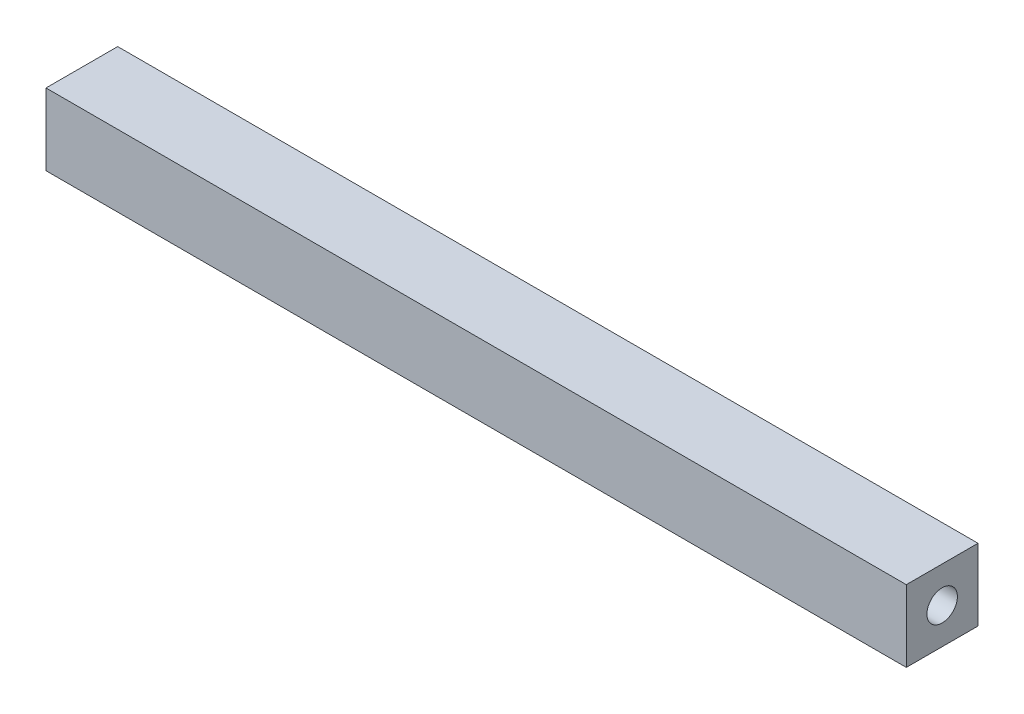
from build123d import *

# Parameters (mm, degrees)
ESBO_O1_W                  = 4
ESBO_O1_H                  = 4
RESSALTO_EXTRUS_O1_DEPTH   = 24
CORTE_EXTRUS_O1_DEPTH      = 49.083261121
CORTE_EXTRUS_O1_DEPTH_BACK = 49.083261121
ESBO_O2_R                  = 0.85


with BuildPart() as part:
    # Esboço1 → Ressalto-extrusão1 (new, symmetric)
    with BuildSketch(Plane(origin=(0, 0, 0), x_dir=(0, 0, -1), z_dir=(1, 0, 0))):
        Rectangle(ESBO_O1_W, ESBO_O1_H)
    extrude(amount=RESSALTO_EXTRUS_O1_DEPTH, both=True)

    # Esboço2 → Corte-extrusão1 (cut, two sides: drawn at the far end of the back side and taken through both)
    with BuildSketch(Plane(origin=(24, 0, 0), x_dir=(0, 0, -1), z_dir=(1, 0, 0)).offset(-CORTE_EXTRUS_O1_DEPTH_BACK)):
        Circle(ESBO_O2_R)
    extrude(amount=CORTE_EXTRUS_O1_DEPTH + CORTE_EXTRUS_O1_DEPTH_BACK, mode=Mode.SUBTRACT)


solid = part.part
